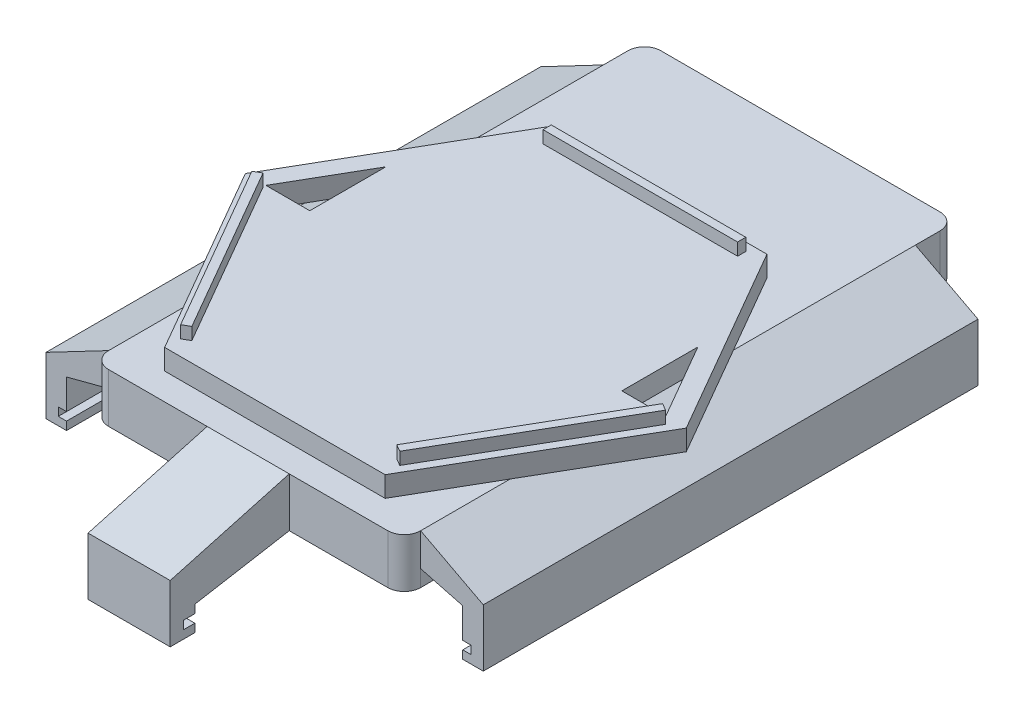
from build123d import *

# Parameters (mm, degrees)
RESSALTO_EXTRUS_O1_DEPTH  = 3
ESBO_O2_W                 = 47.384173958
ESBO_O2_H                 = 2
RESSALTO_EXTRUS_O2_DEPTH  = 3
RESSALTO_EXTRUS_O3_DEPTH  = 2
RESSALTO_EXTRUS_O5_DEPTH  = 12
CORTE_EXTRUS_O1_DEPTH     = 131
CORTE_EXTRUS_O3_DEPTH     = 10
RESSALTO_EXTRUS_O13_DEPTH = 120.5
RESSALTO_EXTRUS_O14_DEPTH = 10
ESBO_O20_W                = 100.5
ESBO_O20_H                = 2
CORTE_EXTRUS_O6_DEPTH     = 150.3


with BuildPart() as part:
    # Esboço1 → Ressalto-extrusão1 (new body)
    with BuildSketch(Plane(origin=(0, 0, 0), x_dir=(1, 0, 0), z_dir=(0, 1, 0))):
        Polygon((53.693575035, 0), (26.846787517, 46.5), (-26.846787517, 46.5), (-53.693575035, 0), (-26.846787517, -46.5), (26.846787517, -46.5), align=None)
    extrude(amount=RESSALTO_EXTRUS_O1_DEPTH)

    # Esboço2 → Ressalto-extrusão2 (add)
    with BuildSketch(Plane(origin=(0, 3, 0), x_dir=(1, 0, 0), z_dir=(0, 1, 0))):
        with Locations((0, 43.5)):
            Rectangle(ESBO_O2_W, ESBO_O2_H)
        Polygon((-50.384173958, -1.732050808), (-26.692086979, -42.767949192), (-24.960036171, -41.767949192), (-48.65212315, -0.732050808), align=None)
        Polygon((26.692086979, -42.767949192), (50.384173958, -1.732050808), (48.65212315, -0.732050808), (24.960036171, -41.767949192), align=None)
    extrude(amount=RESSALTO_EXTRUS_O2_DEPTH)

    # Esboço3 → Ressalto-extrusão3 (add)
    with BuildSketch(Plane.XZ):
        Polygon((26.846787517, 46.5), (-26.846787517, 46.5), (-53.693575035, 0), (-26.846787517, -46.5), (26.846787517, -46.5), (53.693575035, 0), align=None)
    extrude(amount=RESSALTO_EXTRUS_O3_DEPTH)

    # Esboço5 → Ressalto-extrusão5 (add)
    with BuildSketch(Plane.XZ.offset(2)):
        with BuildLine():
            Line((38, 49.00146682), (38, -77.5))
            ThreePointArc((38, -77.5), (36.828427125, -80.328427125), (34, -81.5))
            Line((34, -81.5), (-34, -81.5))
            ThreePointArc((-34, -81.5), (-36.828427125, -80.328427125), (-38, -77.5))
            Line((-38, -77.5), (-38, 49.00146682))
            ThreePointArc((-38, 49.00146682), (-36.828427125, 51.829893945), (-34, 53.00146682))
            Line((-34, 53.00146682), (34, 53.00146682))
            ThreePointArc((34, 53.00146682), (36.828427125, 51.829893945), (38, 49.00146682))
        make_face()
    extrude(amount=RESSALTO_EXTRUS_O5_DEPTH)

    # Esboço7 → Corte-extrusão1 (cut)
    with BuildSketch(Plane(origin=(0, 0, -81.5), x_dir=(-1, 0, 0), z_dir=(0, 0, -1))):
        Polygon((-34.2, -3), (34.2, -3), (34.2, -12.3), (31.2, -12.3), (31.2, -23.281359025), (-31.2, -26.250413902), (-31.2, -12.3), (-34.2, -12.3), align=None)
    extrude(amount=-CORTE_EXTRUS_O1_DEPTH, mode=Mode.SUBTRACT)

    # Esboço8 → Corte-extrusão3 (cut)
    with BuildSketch(Plane.XZ.offset(2)):
        Polygon((-48.693575035, 0), (-38, 0), (-38, -18.521815275), align=None)
        Polygon((38, 0), (48.693575035, 0), (38, -18.521815275), align=None)
    extrude(amount=-CORTE_EXTRUS_O3_DEPTH, mode=Mode.SUBTRACT)

    # Esboço17 → Ressalto-extrusão13 (add)
    with BuildSketch(Plane(origin=(0, 0, -71.5), x_dir=(-1, 0, 0), z_dir=(0, 0, -1))):
        Polygon((-53.25, -20), (-53.25, -18), (-53.25, -10), (-38, -2), (-38, -6), (-38, -10), (-48.25, -12.68852459), (-48.25, -18), (-48.25, -20), (-48.25, -22), (-48.25, -24), (-53.25, -24), (-53.25, -22), align=None)
        Polygon((53.25, -20), (53.25, -18), (53.25, -10), (38, -2), (38, -6), (38, -10), (48.25, -12.68852459), (48.25, -18), (48.25, -20), (48.25, -22), (48.25, -24), (53.25, -24), align=None)
    extrude(amount=-RESSALTO_EXTRUS_O13_DEPTH)

    # Esboço19 → Ressalto-extrusão14 (add, symmetric)
    with BuildSketch(Plane(origin=(0, 0, 0), x_dir=(0, 0, -1), z_dir=(1, 0, 0))):
        Polygon((-53.00146682, -14), (-53.00146682, -2), (-82, -10), (-82, -24), (-76, -24), (-76, -18), align=None)
    extrude(amount=RESSALTO_EXTRUS_O14_DEPTH, both=True)

    # Esboço20 → Corte-extrusão6 (cut)
    with BuildSketch(Plane(origin=(0, 0, -71.5), x_dir=(-1, 0, 0), z_dir=(0, 0, -1))):
        with Locations((0, -21)):
            Rectangle(ESBO_O20_W, ESBO_O20_H)
    extrude(amount=-CORTE_EXTRUS_O6_DEPTH, mode=Mode.SUBTRACT)


solid = part.part
